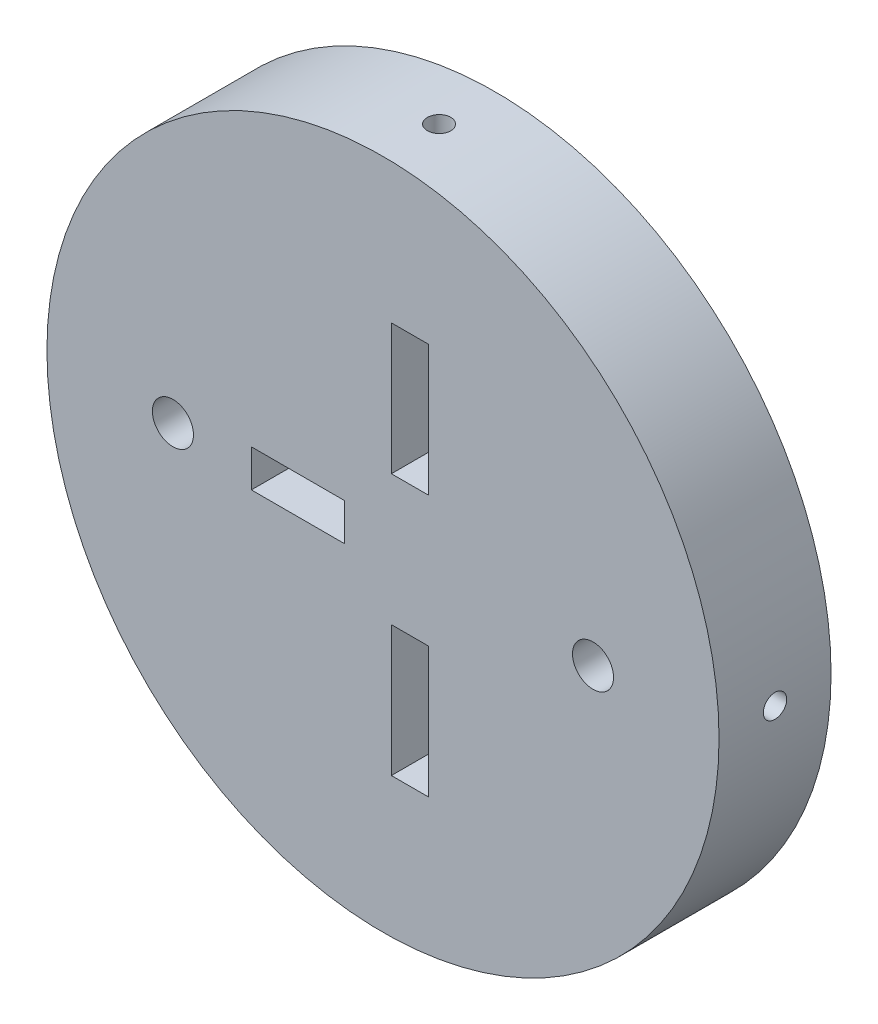
from build123d import *

# Parameters (mm, degrees)
SKETCH1_R           = 45.72
BOSS_EXTRUDE1_DEPTH = 15.24
SKETCH2_R           = 2.794
CUT_EXTRUDE1_DEPTH  = 67.4296199
CUT_EXTRUDE2_START  = 38.1
SKETCH3_R           = 1.5875
CUT_EXTRUDE2_DEPTH  = 15.24
CIRPATTERN1_COUNT   = 4
SKETCH4_W           = 5.08
SKETCH4_H           = 17.78
SKETCH4_W_2         = 12.7
SKETCH4_H_2         = 5.08
CUT_EXTRUDE3_DEPTH  = 67.429620068


with BuildPart() as part:
    # Sketch1 → Boss-Extrude1 (new body)
    with BuildSketch(Plane.XY):
        Circle(SKETCH1_R)
    extrude(amount=BOSS_EXTRUDE1_DEPTH)

    # Sketch2 → Cut-Extrude1 (cut, through all)
    with BuildSketch(Plane.XY.offset(15.24)):
        with Locations((-28.575, 0)):
            Circle(SKETCH2_R)
        with Locations((28.575, 0)):
            Circle(SKETCH2_R)
    extrude(amount=-CUT_EXTRUDE1_DEPTH, mode=Mode.SUBTRACT)

    # Sketch3 → Cut-Extrude2 (cut)
    with BuildSketch(Plane(origin=(0, 0, 0), x_dir=(1, 0, 0), z_dir=(0, 1, 0)).offset(CUT_EXTRUDE2_START)):
        with Locations((0, -7.62)):
            Circle(SKETCH3_R)
    cut_extrude2 = extrude(amount=CUT_EXTRUDE2_DEPTH, mode=Mode.SUBTRACT)

    # CirPattern1: Cut-Extrude2 ×4 about axis
    cirpattern1_axis = Axis((0, 0, 15.24), (0, 0, -1))
    for i in range(1, CIRPATTERN1_COUNT):
        add(cut_extrude2.rotate(cirpattern1_axis, i * 360 / CIRPATTERN1_COUNT), mode=Mode.SUBTRACT)

    # Sketch4 → Cut-Extrude3 (cut, through all)
    with BuildSketch(Plane.XY.offset(15.24)):
        with Locations((3.682680903, 17.78)):
            Rectangle(SKETCH4_W, SKETCH4_H)
        with Locations((3.682680903, -17.78)):
            Rectangle(SKETCH4_W, SKETCH4_H)
        with Locations((-11.557319097, 0)):
            Rectangle(SKETCH4_W_2, SKETCH4_H_2)
    extrude(amount=-CUT_EXTRUDE3_DEPTH, mode=Mode.SUBTRACT)


solid = part.part
